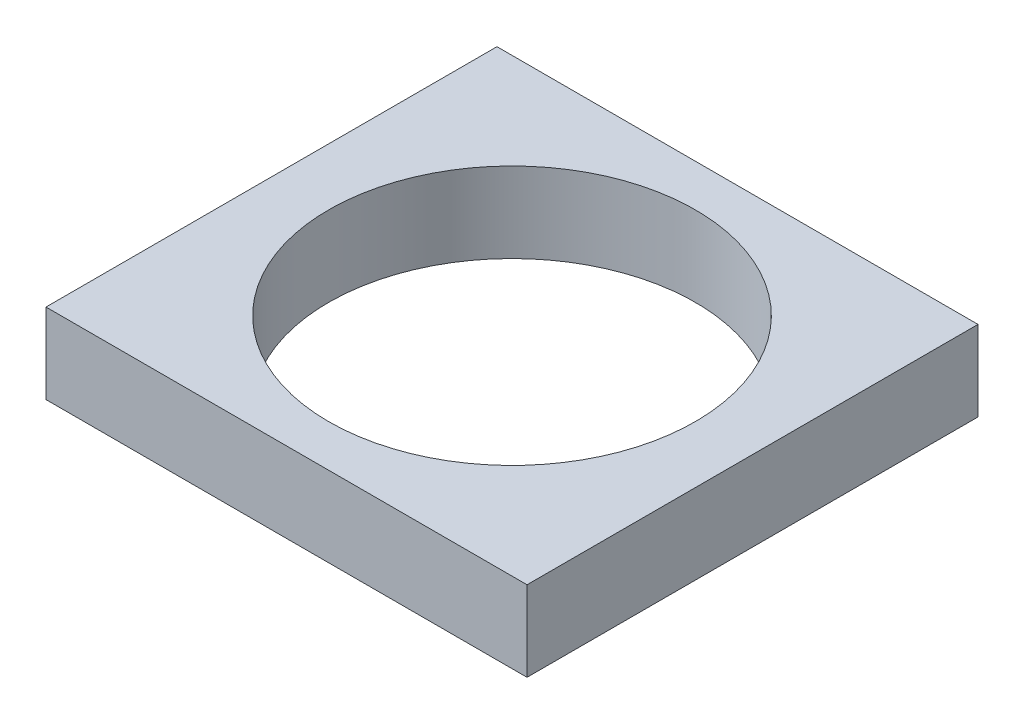
from build123d import *

# Parameters (mm, degrees)
SKETCH1_W           = 24
SKETCH1_H           = 22.5
BOSS_EXTRUDE1_DEPTH = 4
SKETCH2_R           = 9.15
CUT_EXTRUDE1_DEPTH  = 34.13985516


with BuildPart() as part:
    # Sketch1 → Boss-Extrude1 (new body)
    with BuildSketch(Plane(origin=(0, 0, 0), x_dir=(1, 0, 0), z_dir=(0, 1, 0))):
        with Locations((12, -11.25)):
            Rectangle(SKETCH1_W, SKETCH1_H)
    extrude(amount=BOSS_EXTRUDE1_DEPTH)

    # Sketch2 → Cut-Extrude1 (cut, through all)
    with BuildSketch(Plane(origin=(0, 4, 0), x_dir=(1, 0, 0), z_dir=(0, 1, 0))):
        with Locations(Location((12, -11.25, 0), (0, 0, 270))):
            Circle(SKETCH2_R)
    extrude(amount=-CUT_EXTRUDE1_DEPTH, mode=Mode.SUBTRACT)


solid = part.part
